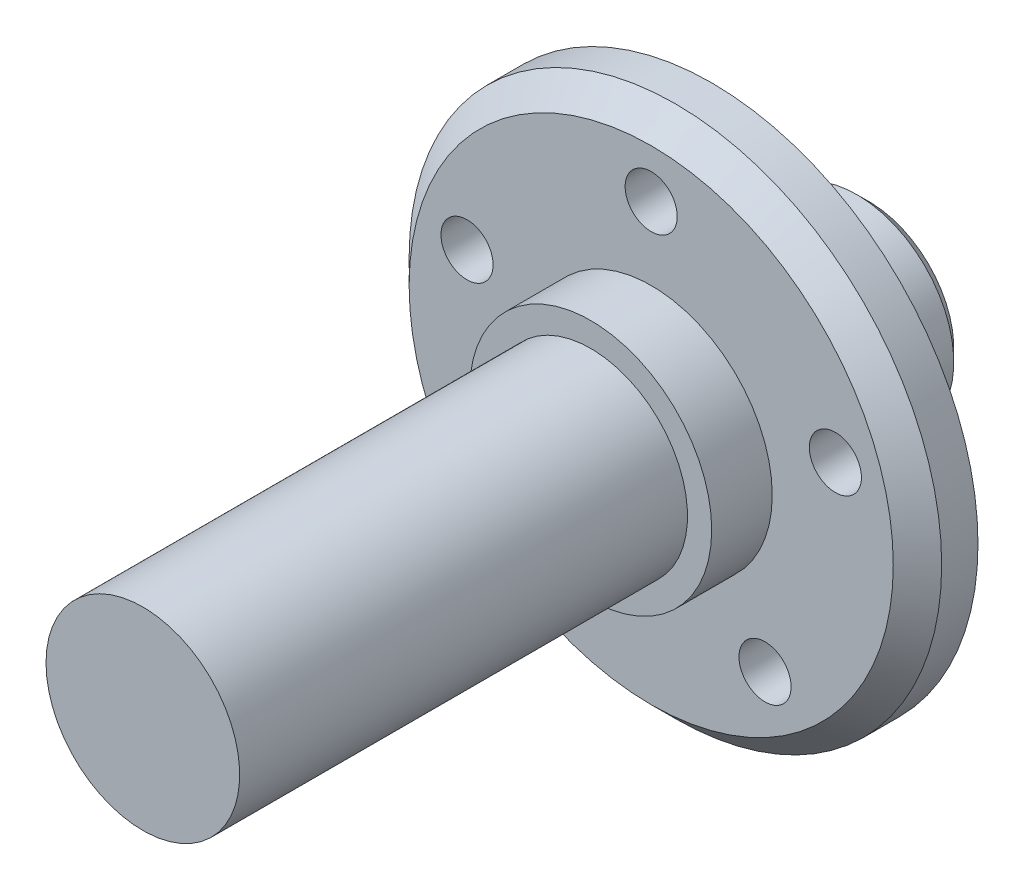
from build123d import *

# Parameters (mm, degrees)
CHAMFER1_SIZE             = 2
F_8_CLEARANCE_HOLE1_D     = 4.3053
F_8_CLEARANCE_HOLE1_DEPTH = 12
F_8_CLEARANCE_HOLE1_TIP   = 1.293442612
CHAMFER2_SIZE             = 1


with BuildPart() as part:
    # Sketch3 → Revolve1 (revolve)
    with BuildSketch(Plane(origin=(0, 0, 0), x_dir=(1, 0, 0), z_dir=(0, 1, 0))):
        Polygon((0, 0), (-8, 0), (-8, 37), (-10, 37), (-10, 42), (-22, 42), (-22, 47), (-8, 47), (-8, 60), (0, 60), align=None)
    revolve(axis=Axis((0, 0, -60), (0, 0, 1)))

    # Chamfer1
    chamfer1_edges = [part.edges().sort_by_distance(p)[0] for p in [
        (22, 0, -42),
    ]]
    chamfer(chamfer1_edges, length=CHAMFER1_SIZE)

    # #8 Clearance Hole1
    with Locations(Plane.XY.offset(-42)):
        with Locations((0, 16), (15.216904261, 4.94427191), (9.404564037, -12.94427191), (-9.404564037, -12.94427191), (-15.216904261, 4.94427191)):
            Hole(F_8_CLEARANCE_HOLE1_D / 2, depth=F_8_CLEARANCE_HOLE1_DEPTH)
            with Locations((0, 0, -(F_8_CLEARANCE_HOLE1_DEPTH + F_8_CLEARANCE_HOLE1_TIP / 2))):  # 118° drill point
                Cone(0, F_8_CLEARANCE_HOLE1_D / 2, F_8_CLEARANCE_HOLE1_TIP, mode=Mode.SUBTRACT)

    # Chamfer2
    chamfer2_edges = [part.edges().sort_by_distance(p)[0] for p in [
        (8, 0, -60),
    ]]
    chamfer(chamfer2_edges, length=CHAMFER2_SIZE)


solid = part.part
